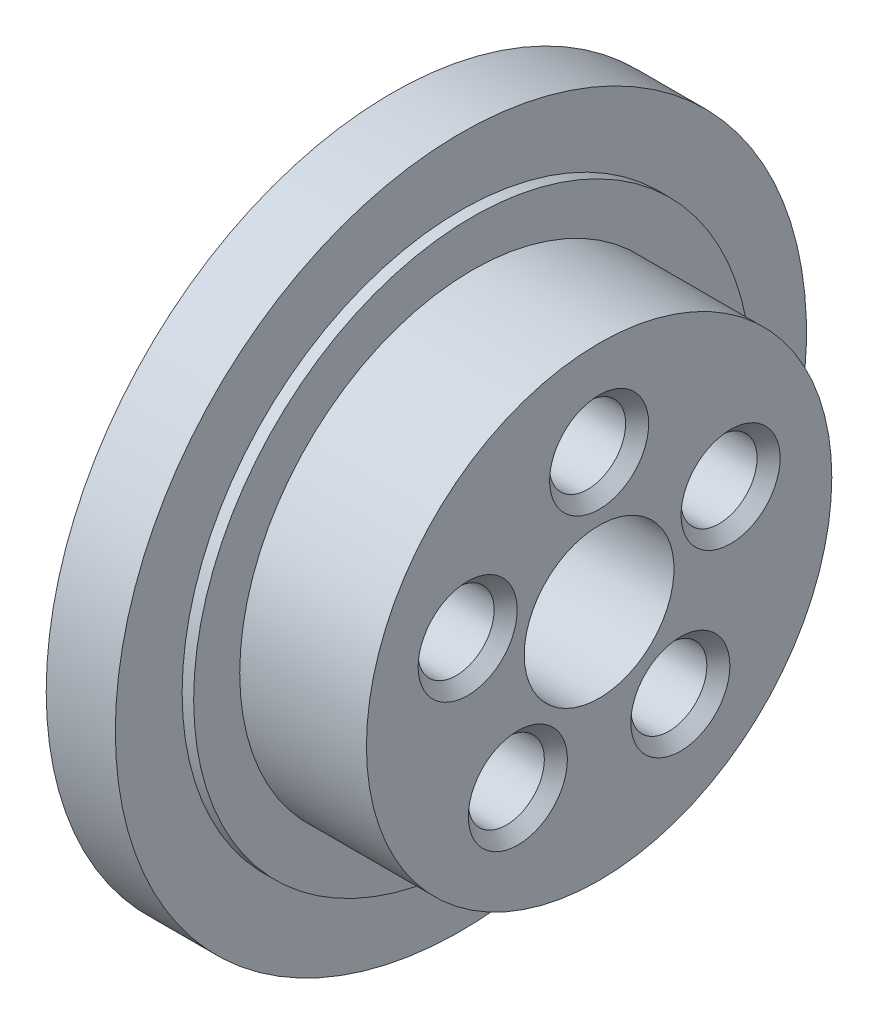
from build123d import *

# Parameters (mm, degrees)
SKETCH2_R          = 2.5
CUT_EXTRUDE1_DEPTH = 4.5
SKETCH3_R          = 3.3
CUT_EXTRUDE2_DEPTH = 10.5
CHAMFER1_SIZE      = 1
SKETCH4_R          = 10
CUT_EXTRUDE3_DEPTH = 2


with BuildPart() as part:
    # Sketch1 → Revolve1 (revolve)
    with BuildSketch(Plane.XY, mode=Mode.PRIVATE) as revolve1_sk:
        Polygon((0, 30), (6, 30), (6, 24.2), (7, 24.2), (7, 20.2), (18, 20.2), (18, 6.5), (6, 6.5), (6, 7.5), (0, 7.5), align=None)
    revolve(revolve1_sk.sketch.rotate(Axis((0, 0, 0), (1, 0, 0)), 90), axis=Axis((0, 0, 0), (1, 0, 0)))

    # Sketch2 → Cut-Extrude1 (cut)
    with BuildSketch(Plane.ZY):
        with Locations((0, 20)):
            Circle(SKETCH2_R)
        with Locations((17.320508076, 10)):
            Circle(SKETCH2_R)
        with Locations((17.320508076, -10)):
            Circle(SKETCH2_R)
        with Locations((0, -20)):
            Circle(SKETCH2_R)
        with Locations((-17.320508076, -10)):
            Circle(SKETCH2_R)
        with Locations((-17.320508076, 10)):
            Circle(SKETCH2_R)
    extrude(amount=-CUT_EXTRUDE1_DEPTH, mode=Mode.SUBTRACT)

    # Sketch3 → Cut-Extrude2 (cut)
    with BuildSketch(Plane(origin=(18, 0, 0), x_dir=(0, 0, -1), z_dir=(1, 0, 0))):
        with Locations((0, 12)):
            Circle(SKETCH3_R)
        with Locations((11.412678196, 3.708203932)):
            Circle(SKETCH3_R)
        with Locations((7.053423028, -9.708203932)):
            Circle(SKETCH3_R)
        with Locations((-7.053423028, -9.708203932)):
            Circle(SKETCH3_R)
        with Locations((-11.412678196, 3.708203932)):
            Circle(SKETCH3_R)
    extrude(amount=-CUT_EXTRUDE2_DEPTH, mode=Mode.SUBTRACT)

    # Chamfer1
    chamfer1_edges = [part.edges().sort_by_distance(p)[0] for p in [
        (18, 12, 3.3),
        (18, 3.708203932, -8.112678196),
        (18, -9.708203932, -3.753423028),
        (18, -9.708203932, 10.353423028),
        (18, 3.708203932, 14.712678196),
    ]]
    chamfer(chamfer1_edges, length=CHAMFER1_SIZE)

    # Sketch4 → Cut-Extrude3 (cut)
    with BuildSketch(Plane.ZY):
        Circle(SKETCH4_R)
    extrude(amount=-CUT_EXTRUDE3_DEPTH, mode=Mode.SUBTRACT)


solid = part.part
